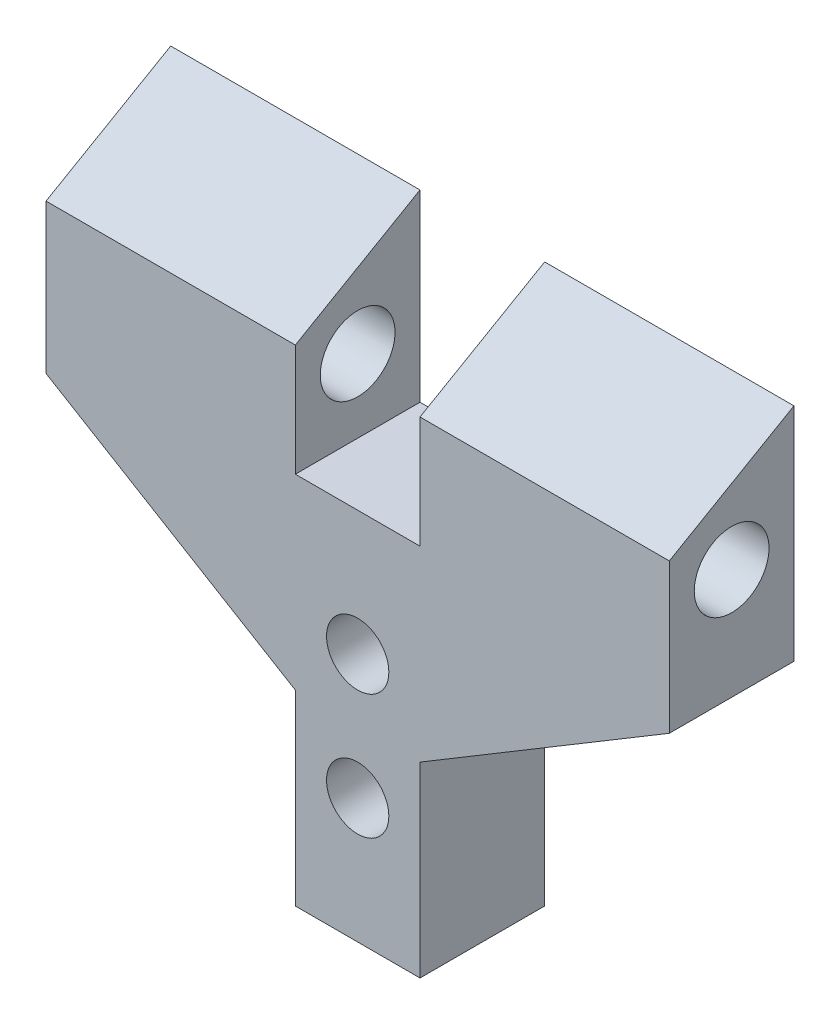
from build123d import *

# Parameters (mm, degrees)
ESQUISSE1_R             = 2.5
BOSS_EXTRU_1_DEPTH      = 10
ENL_V_MAT_EXTRU_1_REACH = 61.034
ESQUISSE2_R             = 3


with BuildPart() as part:
    # Esquisse1 → Boss.-Extru.1 (new body)
    with BuildSketch(Plane.XY):
        Polygon((-25, 12), (-5, 0), (-5, -15), (5, -15), (5, 0), (25, 12), (25, 29.75), (5, 29.75), (5, 15), (-5, 15), (-5, 29.75), (-25, 29.75), align=None)
        with Locations((0, -5)):
            Circle(ESQUISSE1_R, mode=Mode.SUBTRACT)
        with Locations((0, 5)):
            Circle(ESQUISSE1_R, mode=Mode.SUBTRACT)
    extrude(amount=BOSS_EXTRU_1_DEPTH)

    # Enlèv. mat.-Extru.1: up to this face of the body (flat: up to its plane)
    enl_v_mat_extru_1_end = Plane(part.part.faces().sort_by_distance((25, 20.875, 5))[0])
    # Esquisse2 → Enlèv. mat.-Extru.1 (cut, up to the picked face)
    with BuildSketch(Plane.ZY.offset(25), mode=Mode.PRIVATE) as enl_v_mat_extru_1_sk1:
        with Locations((5, 20.875)):
            Circle(ESQUISSE2_R)
    enl_v_mat_extru_1_tool1 = split(extrude(enl_v_mat_extru_1_sk1.sketch, amount=-ENL_V_MAT_EXTRU_1_REACH, mode=Mode.PRIVATE), bisect_by=enl_v_mat_extru_1_end, keep=Keep.BOTH, mode=Mode.PRIVATE)
    # Esquisse2 → Enlèv. mat.-Extru.1 (cut, up to the picked face)
    with BuildSketch(Plane.ZY.offset(25), mode=Mode.PRIVATE) as enl_v_mat_extru_1_sk2:
        Polygon((0, 29.75), (10, 29.75), (10, 23.976497308), align=None)
    enl_v_mat_extru_1_tool2 = split(extrude(enl_v_mat_extru_1_sk2.sketch, amount=-ENL_V_MAT_EXTRU_1_REACH, mode=Mode.PRIVATE), bisect_by=enl_v_mat_extru_1_end, keep=Keep.BOTH, mode=Mode.PRIVATE)
    add(enl_v_mat_extru_1_tool1.solids().sort_by(Axis((-25, 20.875, 5), (1, 0, 0)))[0], mode=Mode.SUBTRACT)
    add(enl_v_mat_extru_1_tool2.solids().sort_by(Axis((-25, 27.825499, 6.666667), (1, 0, 0)))[0], mode=Mode.SUBTRACT)


solid = part.part
